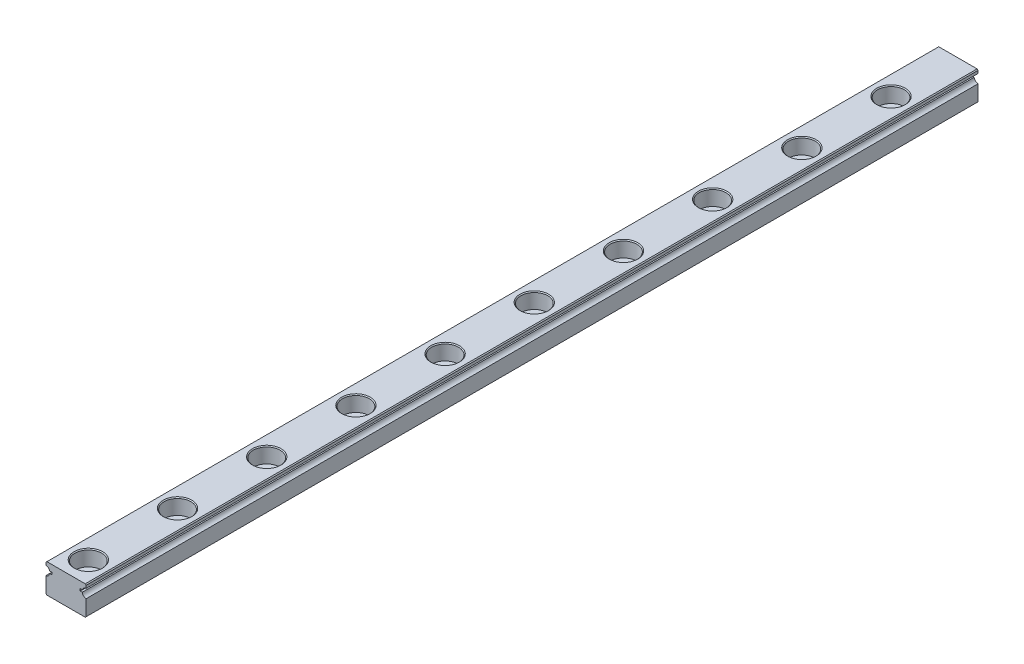
from build123d import *

# Parameters (mm, degrees)
EXTRUDE1_DEPTH             = 200
EXTRUDE2_REACH             = 202.156
SKETCH2_R                  = 1.75
SKETCH_R                   = 3
SKETCH_R_2                 = 1.75
EXTRUDE4_DEPTH             = 3.5
CHAMFER1_SIZE              = 0.2
LPATTERN1_COUNT            = 10
LPATTERN1_PITCH            = 20
CHAMFER1_OF_LPATTERN1_SIZE = 0.2


with BuildPart() as part:
    # Sketch1 → Extrude1 (new body)
    with BuildSketch(Plane.XY):
        with BuildLine():
            Line((-4.3, -3.25), (4.3, -3.25))
            Line((4.3, -3.25), (4.5, -3.05))
            Line((4.5, -3.05), (4.5, 0.455012563))
            ThreePointArc((4.5, 0.455012563), (3.924845827, 0.712323349), (3.617735397, 1.2625))
            Line((3.617735397, 1.2625), (3.15008224, 1.2625))
            Line((3.15008224, 1.2625), (3.15008224, 1.7625))
            Line((3.15008224, 1.7625), (3.65008224, 1.7625))
            ThreePointArc((3.65008224, 1.7625), (3.973877727, 2.229724887), (4.5, 2.444987437))
            Line((4.5, 2.444987437), (4.5, 3.05))
            Line((4.5, 3.05), (4.3, 3.25))
            Line((4.3, 3.25), (-4.3, 3.25))
            Line((-4.3, 3.25), (-4.5, 3.05))
            Line((-4.5, 3.05), (-4.5, 2.444987437))
            ThreePointArc((-4.5, 2.444987437), (-3.973877727, 2.229724887), (-3.65008224, 1.7625))
            Line((-3.65008224, 1.7625), (-3.15008224, 1.7625))
            Line((-3.15008224, 1.7625), (-3.15008224, 1.2625))
            Line((-3.15008224, 1.2625), (-3.617735397, 1.2625))
            ThreePointArc((-3.617735397, 1.2625), (-3.924845827, 0.712323349), (-4.5, 0.455012563))
            Line((-4.5, 0.455012563), (-4.5, -3.05))
            Line((-4.5, -3.05), (-4.3, -3.25))
        make_face()
    extrude(amount=EXTRUDE1_DEPTH)

    # Sketch2 → Extrude2 (cut, up to next)
    with BuildSketch(Plane(origin=(0, 3.25, 0), x_dir=(1, 0, 0), z_dir=(0, 1, 0)), mode=Mode.PRIVATE) as extrude2_sk1:
        with Locations((0, -15)):
            Circle(SKETCH2_R)
    extrude2_tool1 = extrude(extrude2_sk1.sketch, amount=-EXTRUDE2_REACH, mode=Mode.PRIVATE) & part.part
    extrude2 = extrude2_tool1.solids().sort_by_distance((0, 3.25, 15))[0]
    add(extrude2, mode=Mode.SUBTRACT)

    # Sketch → Extrude4 (cut)
    with BuildSketch(Plane(origin=(0, 3.25, 0), x_dir=(1, 0, 0), z_dir=(0, 1, 0))):
        with Locations((0, -15)):
            Circle(SKETCH_R)
        with Locations((0, -15)):
            Circle(SKETCH_R_2, mode=Mode.SUBTRACT)
    extrude4 = extrude(amount=-EXTRUDE4_DEPTH, mode=Mode.SUBTRACT)

    # Chamfer1
    chamfer1_edges = [part.edges().sort_by_distance(p)[0] for p in [
        (-1.75, -3.25, 15),
        (-3, 3.25, 15),
    ]]
    chamfer(chamfer1_edges, length=CHAMFER1_SIZE)

    # LPattern1: Extrude2, Extrude4 ×10
    with Locations(*[(0, 0, i * LPATTERN1_PITCH) for i in range(1, LPATTERN1_COUNT)]):
        add(extrude2, mode=Mode.SUBTRACT)
        add(extrude4, mode=Mode.SUBTRACT)

    # Chamfer1 of LPattern1
    chamfer1_of_lpattern1_edges = [part.edges().sort_by_distance(p)[0] for p in [
        (-1.75, -3.25, 35),
        (-3, 3.25, 35),
        (-1.75, -3.25, 55),
        (-3, 3.25, 55),
        (-1.75, -3.25, 75),
        (-3, 3.25, 75),
        (-1.75, -3.25, 95),
        (-3, 3.25, 95),
        (-1.75, -3.25, 115),
        (-3, 3.25, 115),
        (-1.75, -3.25, 135),
        (-3, 3.25, 135),
        (-1.75, -3.25, 155),
        (-3, 3.25, 155),
        (-1.75, -3.25, 175),
        (-3, 3.25, 175),
        (-1.75, -3.25, 195),
        (-3, 3.25, 195),
    ]]
    chamfer(chamfer1_of_lpattern1_edges, length=CHAMFER1_OF_LPATTERN1_SIZE)


solid = part.part
